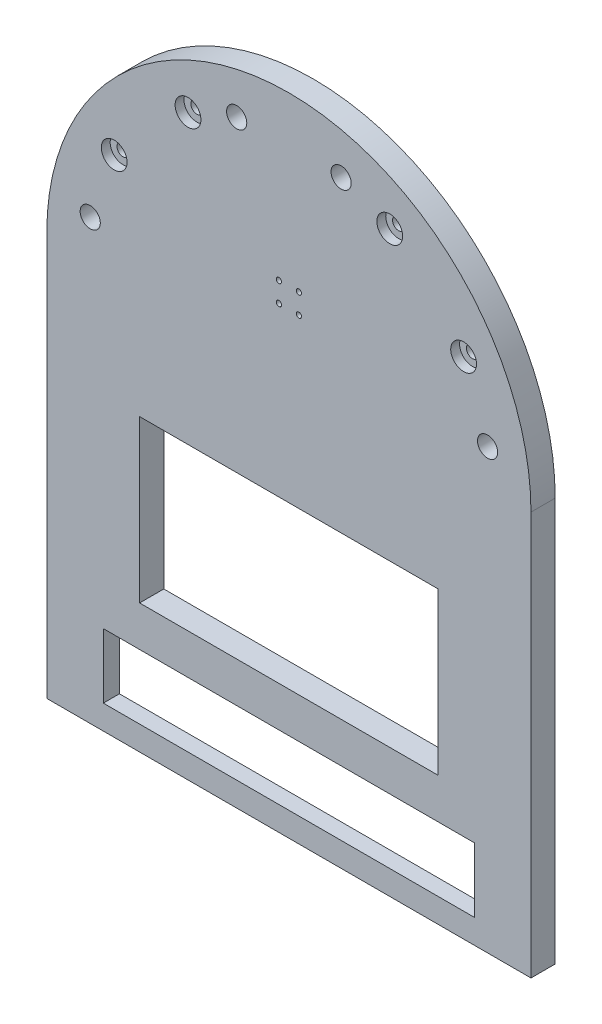
from build123d import *

# Parameters (mm, degrees)
SKETCH_1_R           = 16
EXTRUDE_1_DEPTH      = 30
SKETCH_5_W           = 370
SKETCH_5_H           = 200
CUT_EXTRUDE_3_DEPTH  = 584.86642308
SKETCH_6_W           = 460
SKETCH_6_H           = 80
CUT_EXTRUDE_4_DEPTH  = 100
SKETCH_7_W           = 520
SKETCH_7_H           = 140
CUT_EXTRUDE_5_DEPTH  = 10
SKETCH_10_R          = 12.5
CUT_EXTRUDE_7_DEPTH  = 30
SKETCH_15_R          = 3
CUT_EXTRUDE_12_DEPTH = 10
SKETCH_16_R          = 18.5
SKETCH_16_R_2        = 12.5
EXTRUDE_2_DEPTH      = 5
SKETCH_17_R          = 16
SKETCH_17_R_2        = 7.55
EXTRUDE_4_DEPTH      = 19
EXTRUDE_START        = -10
SKETCH_18_R          = 12.5
EXTRUDE_5_DEPTH      = 10
SKETCH_19_R          = 3.25
CUT_EXTRUDE_13_DEPTH = 10


with BuildPart() as part:
    # 草图1 → 凸台-拉伸1 (new body)
    with BuildSketch(Plane.XY):
        with BuildLine():
            Line((-300, 0), (-300, -500))
            Line((-300, -500), (300, -500))
            Line((300, -500), (300, 0))
            ThreePointArc((300, 0), (0, 300), (-300, 0))
        make_face()
        with Locations((-216.506350946, 125)):
            Circle(SKETCH_1_R, mode=Mode.SUBTRACT)
        with Locations((-125, 216.506350946)):
            Circle(SKETCH_1_R, mode=Mode.SUBTRACT)
        with Locations(Location((125, 216.506350946, 0), (0, 0, 180))):
            Circle(SKETCH_1_R, mode=Mode.SUBTRACT)
        with Locations(Location((216.506350946, 125, 0), (0, 0, 180))):
            Circle(SKETCH_1_R, mode=Mode.SUBTRACT)
    extrude(amount=EXTRUDE_1_DEPTH)

    # 草图5 → 切除-拉伸3 (cut, through all)
    with BuildSketch(Plane.XY.offset(30)):
        with Locations((0, -240)):
            Rectangle(SKETCH_5_W, SKETCH_5_H)
    extrude(amount=-CUT_EXTRUDE_3_DEPTH, mode=Mode.SUBTRACT)

    # 草图6 → 切除-拉伸4 (cut)
    with BuildSketch(Plane.XY.offset(30)):
        with Locations((0, -430)):
            Rectangle(SKETCH_6_W, SKETCH_6_H)
    extrude(amount=-CUT_EXTRUDE_4_DEPTH, mode=Mode.SUBTRACT)

    # 草图7 → 切除-拉伸5 (cut)
    with BuildSketch(Plane(origin=(0, 0, 0), x_dir=(-1, 0, 0), z_dir=(0, 0, -1))):
        with Locations((0, -430)):
            Rectangle(SKETCH_7_W, SKETCH_7_H)
    extrude(amount=-CUT_EXTRUDE_5_DEPTH, mode=Mode.SUBTRACT)

    # 草图10 → 切除-拉伸7 (cut)
    with BuildSketch(Plane.XY.offset(30)):
        with Locations((-246.201938253, 43.412044417)):
            Circle(SKETCH_10_R)
        with Locations((-64.704761276, 241.481456572)):
            Circle(SKETCH_10_R)
        with Locations(Location((246.201938253, 43.412044417, 0), (0, 0, 180))):
            Circle(SKETCH_10_R)
        with Locations(Location((64.704761276, 241.481456572, 0), (0, 0, 180))):
            Circle(SKETCH_10_R)
    extrude(amount=-CUT_EXTRUDE_7_DEPTH, mode=Mode.SUBTRACT)

    # 草图15 → 切除-拉伸12 (cut)
    with BuildSketch(Plane(origin=(0, 0, 10), x_dir=(-1, 0, 0), z_dir=(0, 0, -1))):
        with Locations((0, -370)):
            Circle(SKETCH_15_R)
        with Locations((-82, -370)):
            Circle(SKETCH_15_R)
        with Locations((-164, -370)):
            Circle(SKETCH_15_R)
        with Locations((-246, -370)):
            Circle(SKETCH_15_R)
        with Locations(Location((-246, -490, 0), (0, 0, 180))):
            Circle(SKETCH_15_R)
        with Locations(Location((-164, -490, 0), (0, 0, 180))):
            Circle(SKETCH_15_R)
        with Locations(Location((-82, -490, 0), (0, 0, 180))):
            Circle(SKETCH_15_R)
        with Locations(Location((0, -490, 0), (0, 0, 180))):
            Circle(SKETCH_15_R)
        with Locations((82, -490)):
            Circle(SKETCH_15_R)
        with Locations((164, -490)):
            Circle(SKETCH_15_R)
        with Locations((246, -490)):
            Circle(SKETCH_15_R)
        with Locations(Location((246, -370, 0), (0, 0, 180))):
            Circle(SKETCH_15_R)
        with Locations(Location((164, -370, 0), (0, 0, 180))):
            Circle(SKETCH_15_R)
        with Locations(Location((82, -370, 0), (0, 0, 180))):
            Circle(SKETCH_15_R)
        with Locations((-246, -430)):
            Circle(SKETCH_15_R)
        with Locations((246, -430)):
            Circle(SKETCH_15_R)
    extrude(amount=-CUT_EXTRUDE_12_DEPTH, mode=Mode.SUBTRACT)

    # 草图16 → 凸台-拉伸2 (add)
    # profile 1 of 4: a face of its own
    with BuildSketch(Plane(origin=(0, 0, 0), x_dir=(-1, 0, 0), z_dir=(0, 0, -1))):
        with Locations((-216.506350946, 125)):
            Circle(SKETCH_16_R)
        with Locations((-216.506350946, 125)):
            Circle(SKETCH_16_R_2, mode=Mode.SUBTRACT)
    # profile 2 of 4: a face of its own
    with BuildSketch(Plane(origin=(0, 0, 0), x_dir=(-1, 0, 0), z_dir=(0, 0, -1))):
        with Locations((-125, 216.506350946)):
            Circle(SKETCH_16_R)
        with Locations((-125, 216.506350946)):
            Circle(SKETCH_16_R_2, mode=Mode.SUBTRACT)
    # profile 3 of 4: a face of its own
    with BuildSketch(Plane(origin=(0, 0, 0), x_dir=(-1, 0, 0), z_dir=(0, 0, -1))):
        with Locations((125, 216.506350946)):
            Circle(SKETCH_16_R)
        with Locations(Location((125, 216.506350946, 0), (0, 0, 180))):
            Circle(SKETCH_16_R_2, mode=Mode.SUBTRACT)
    # profile 4 of 4: a face of its own
    with BuildSketch(Plane(origin=(0, 0, 0), x_dir=(-1, 0, 0), z_dir=(0, 0, -1))):
        with Locations((216.506350946, 125)):
            Circle(SKETCH_16_R)
        with Locations(Location((216.506350946, 125, 0), (0, 0, 180))):
            Circle(SKETCH_16_R_2, mode=Mode.SUBTRACT)
    extrude(amount=-EXTRUDE_2_DEPTH)

    # 草图17 → 凸台-拉伸4 (add)
    # profile 1 of 4: a face of its own
    with BuildSketch(Plane(origin=(0, 0, 0), x_dir=(-1, 0, 0), z_dir=(0, 0, -1))):
        with Locations(Location((216.506350946, 125, 0), (0, 0, 180))):
            Circle(SKETCH_17_R)
        with Locations((216.506350946, 125)):
            Circle(SKETCH_17_R_2, mode=Mode.SUBTRACT)
    # profile 2 of 4: a face of its own
    with BuildSketch(Plane(origin=(0, 0, 0), x_dir=(-1, 0, 0), z_dir=(0, 0, -1))):
        with Locations(Location((125, 216.506350946, 0), (0, 0, 180))):
            Circle(SKETCH_17_R)
        with Locations((125, 216.506350946)):
            Circle(SKETCH_17_R_2, mode=Mode.SUBTRACT)
    # profile 3 of 4: a face of its own
    with BuildSketch(Plane(origin=(0, 0, 0), x_dir=(-1, 0, 0), z_dir=(0, 0, -1))):
        with Locations((-125, 216.506350946)):
            Circle(SKETCH_17_R)
        with Locations(Location((-125, 216.506350946, 0), (0, 0, 180))):
            Circle(SKETCH_17_R_2, mode=Mode.SUBTRACT)
    # profile 4 of 4: a face of its own
    with BuildSketch(Plane(origin=(0, 0, 0), x_dir=(-1, 0, 0), z_dir=(0, 0, -1))):
        with Locations((-216.506350946, 125)):
            Circle(SKETCH_17_R)
        with Locations(Location((-216.506350946, 125, 0), (0, 0, 180))):
            Circle(SKETCH_17_R_2, mode=Mode.SUBTRACT)
    extrude(amount=-EXTRUDE_4_DEPTH)

    # 草图18 → 凸台-拉伸5 (add)
    with BuildSketch(Plane(origin=(0, 0, 0), x_dir=(-1, 0, 0), z_dir=(0, 0, -1)).offset(EXTRUDE_START)):
        with Locations((-246.201938253, 43.412044417)):
            Circle(SKETCH_18_R)
        with Locations((-64.704761276, 241.481456572)):
            Circle(SKETCH_18_R)
        with Locations(Location((64.704761276, 241.481456572, 0), (0, 0, 180))):
            Circle(SKETCH_18_R)
        with Locations(Location((246.201938253, 43.412044417, 0), (0, 0, 180))):
            Circle(SKETCH_18_R)
    extrude(amount=EXTRUDE_5_DEPTH)

    # 草图19 → 切除-拉伸13 (cut)
    with BuildSketch(Plane.XY.offset(30)):
        with Locations((-12.375, 92.375)):
            Circle(SKETCH_19_R)
        with Locations((12.375, 92.375)):
            Circle(SKETCH_19_R)
        with Locations((-12.375, 67.625)):
            Circle(SKETCH_19_R)
        with Locations((12.375, 67.625)):
            Circle(SKETCH_19_R)
    extrude(amount=-CUT_EXTRUDE_13_DEPTH, mode=Mode.SUBTRACT)


solid = part.part
